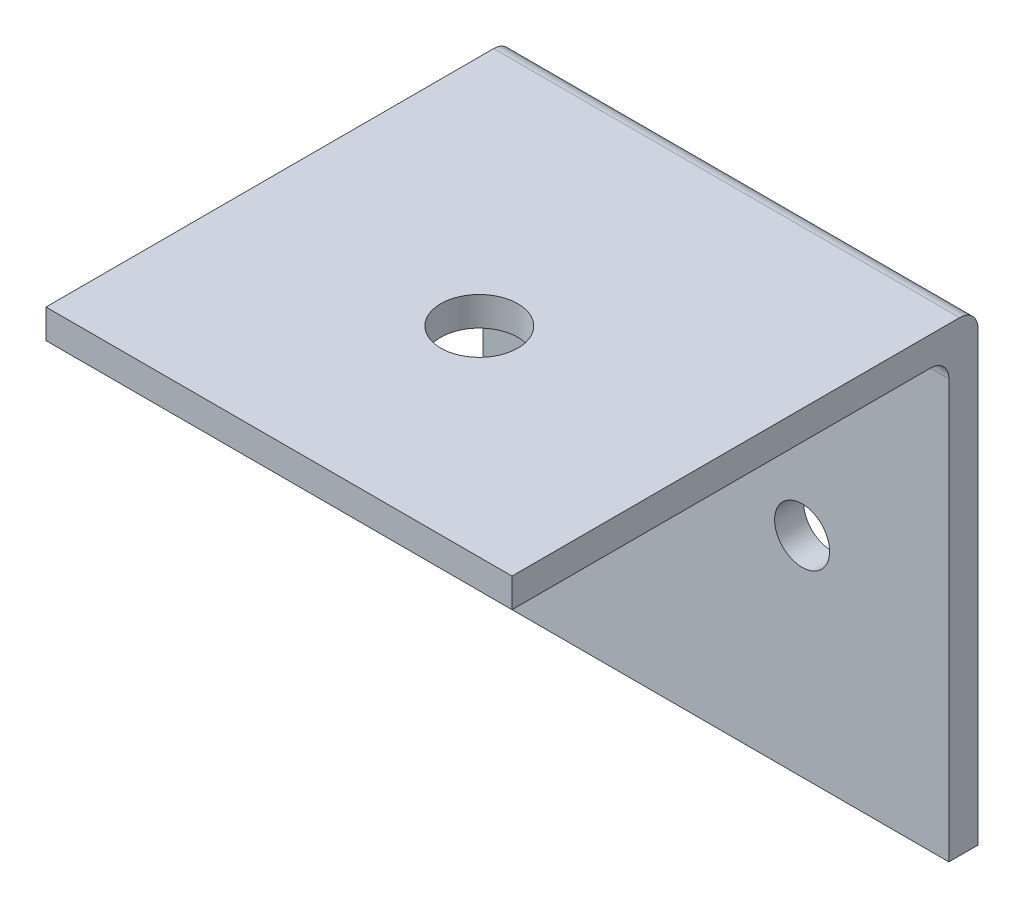
from build123d import *

# Parameters (mm, degrees)
BOSS_EXTRUDE1_DEPTH = 25.4
SKETCH2_R           = 1.5
CUT_EXTRUDE1_DEPTH  = 25.4
SKETCH3_R           = 2.1
CUT_EXTRUDE2_DEPTH  = 25.4


with BuildPart() as part:
    # Sketch1 → Boss-Extrude1 (new body)
    with BuildSketch(Plane(origin=(0, 0, 0), x_dir=(0, 0, -1), z_dir=(1, 0, 0))):
        with BuildLine():
            Line((11.1125, -12.7), (12.7, -12.7))
            Line((12.7, -12.7), (12.7, 11.7))
            ThreePointArc((12.7, 11.7), (12.407106781, 12.407106781), (11.7, 12.7))
            Line((11.7, 12.7), (-12.7, 12.7))
            Line((-12.7, 12.7), (-12.7, 11.1125))
            Line((-12.7, 11.1125), (10.1125, 11.1125))
            ThreePointArc((10.1125, 11.1125), (10.819606781, 10.819606781), (11.1125, 10.1125))
            Line((11.1125, 10.1125), (11.1125, -12.7))
        make_face()
    extrude(amount=BOSS_EXTRUDE1_DEPTH)

    # Sketch2 → Cut-Extrude1 (cut)
    with BuildSketch(Plane.XY.offset(-11.1125)):
        with Locations((8, -1.29375)):
            Circle(SKETCH2_R)
        with Locations((17.4, -1.29375)):
            Circle(SKETCH2_R)
    extrude(amount=-CUT_EXTRUDE1_DEPTH, mode=Mode.SUBTRACT)

    # Sketch3 → Cut-Extrude2 (cut)
    with BuildSketch(Plane.XZ.offset(-11.1125)):
        with Locations(Location((12.7, 1.783154784, 0), (0, 0, 270))):
            Circle(SKETCH3_R)
    extrude(amount=-CUT_EXTRUDE2_DEPTH, mode=Mode.SUBTRACT)


solid = part.part
